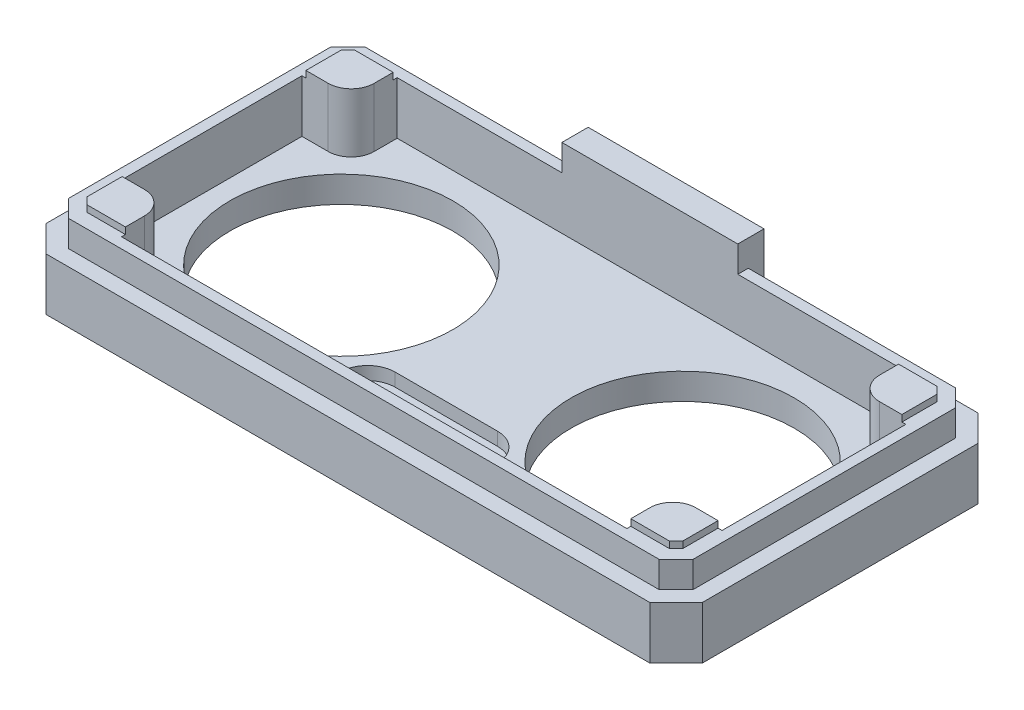
from build123d import *

# Parameters (mm, degrees)
BOSS_EXTRUDE1_DEPTH = 2
BOSS_EXTRUDE2_DEPTH = 4
BOSS_EXTRUDE3_DEPTH = 4
SKETCH3_R           = 8.5
FORSENSORS_DEPTH    = 5
FORCRYSTAL_DEPTH    = 1
PCBLEDGE_DEPTH      = 0.5
GROOVE_DEPTH        = 2
SKETCH7_W           = 13.4
SKETCH7_H           = 2
BOSS_EXTRUDE5_DEPTH = 2


with BuildPart() as part:
    # Sketch1 → Boss-Extrude1 (new body)
    with BuildSketch(Plane(origin=(0, 0, 0), x_dir=(1, 0, 0), z_dir=(0, 1, 0))):
        Polygon((7, 12.5), (-23, 12.5), (-25, 10.5), (-25, -10.5), (-23, -12.5), (23, -12.5), (25, -10.5), (25, 10.5), (23, 12.5), align=None)
    extrude(amount=BOSS_EXTRUDE1_DEPTH)

    # Sketch2 → Boss-Extrude2 (add)
    with BuildSketch(Plane(origin=(0, 2, 0), x_dir=(1, 0, 0), z_dir=(0, 1, 0))):
        with BuildLine():
            Line((-19.25, 8.75), (-19.25, 10.5))
            Line((-19.25, 10.5), (-22.171572875, 10.5))
            Line((-22.171572875, 10.5), (-23, 9.671572875))
            Line((-23, 9.671572875), (-23, 7))
            Line((-23, 7), (-21, 7))
            ThreePointArc((-21, 7), (-19.762563133, 7.512563133), (-19.25, 8.75))
        make_face()
        with BuildLine():
            Line((22.171572875, 10.5), (19.25, 10.5))
            Line((19.25, 10.5), (19.25, 8.75))
            ThreePointArc((19.25, 8.75), (19.762563133, 7.512563133), (21, 7))
            Line((21, 7), (23, 7))
            Line((23, 7), (23, 9.671572875))
            Line((23, 9.671572875), (22.171572875, 10.5))
        make_face()
        with BuildLine():
            Line((-21, -7), (-23, -7))
            Line((-23, -7), (-23, -9.671572875))
            Line((-23, -9.671572875), (-22.171572875, -10.5))
            Line((-22.171572875, -10.5), (-19.25, -10.5))
            Line((-19.25, -10.5), (-19.25, -8.75))
            ThreePointArc((-19.25, -8.75), (-19.762563133, -7.512563133), (-21, -7))
        make_face()
        with BuildLine():
            Line((23, -9.671572875), (23, -7))
            Line((23, -7), (21, -7))
            ThreePointArc((21, -7), (19.762563133, -7.512563133), (19.25, -8.75))
            Line((19.25, -8.75), (19.25, -10.5))
            Line((19.25, -10.5), (22.171572875, -10.5))
            Line((22.171572875, -10.5), (23, -9.671572875))
        make_face()
    extrude(amount=BOSS_EXTRUDE2_DEPTH)

    # Sketch2<3> → Boss-Extrude3 (add)
    with BuildSketch(Plane(origin=(0, 2, 0), x_dir=(1, 0, 0), z_dir=(0, 1, 0))):
        Polygon((23, 12.5), (7.5, 12.5), (-7.5, 12.5), (-23, 12.5), (-25, 10.5), (-25, -10.5), (-23, -12.5), (0, -12.5), (23, -12.5), (25, -10.5), (25, 10.5), align=None)
        Polygon((-19.25, 10.5), (-1.449649569, 10.5), (1.449649569, 10.5), (19.25, 10.5), (22.171572875, 10.5), (23, 9.671572875), (23, 7), (23, -7), (23, -9.671572875), (22.171572875, -10.5), (19.25, -10.5), (0, -10.5), (-19.25, -10.5), (-22.171572875, -10.5), (-23, -9.671572875), (-23, -7), (-23, 7), (-23, 9.671572875), (-22.171572875, 10.5), align=None, mode=Mode.SUBTRACT)
    extrude(amount=BOSS_EXTRUDE3_DEPTH)

    # Sketch3 → ForSensors (cut)
    with BuildSketch(Plane.XZ):
        with Locations((-13, 0)):
            Circle(SKETCH3_R)
        with Locations((13, 0)):
            Circle(SKETCH3_R)
    extrude(amount=-FORSENSORS_DEPTH, mode=Mode.SUBTRACT)

    # Sketch4 → ForCrystal (cut)
    with BuildSketch(Plane(origin=(0, 2, 0), x_dir=(1, 0, 0), z_dir=(0, 1, 0))):
        with BuildLine():
            Line((3.9, -9.2), (-3.9, -9.2))
            ThreePointArc((-3.9, -9.2), (-6, -7.1), (-3.9, -5))
            Line((-3.9, -5), (3.9, -5))
            ThreePointArc((3.9, -5), (6, -7.1), (3.9, -9.2))
        make_face()
    extrude(amount=-FORCRYSTAL_DEPTH, mode=Mode.SUBTRACT)

    # Sketch5 → PcbLedge (add)
    with BuildSketch(Plane(origin=(0, 6, 0), x_dir=(1, 0, 0), z_dir=(0, 1, 0))):
        with BuildLine():
            ThreePointArc((19.25, 8.75), (19.762563133, 7.512563133), (21, 7))
            Line((21, 7), (22.7, 7))
            Line((22.7, 7), (22.7, 9.688730163))
            Line((22.7, 9.688730163), (22.188730163, 10.2))
            Line((22.188730163, 10.2), (19.25, 10.2))
            Line((19.25, 10.2), (19.25, 8.75))
        make_face()
        with BuildLine():
            Line((22.7, -7), (21, -7))
            ThreePointArc((21, -7), (19.762563133, -7.512563133), (19.25, -8.75))
            Line((19.25, -8.75), (19.25, -10.2))
            Line((19.25, -10.2), (22.188730163, -10.2))
            Line((22.188730163, -10.2), (22.7, -9.688730163))
            Line((22.7, -9.688730163), (22.7, -7))
        make_face()
        with BuildLine():
            ThreePointArc((-21, 7), (-19.762563133, 7.512563133), (-19.25, 8.75))
            Line((-19.25, 8.75), (-19.25, 10.2))
            Line((-19.25, 10.2), (-22.188730163, 10.2))
            Line((-22.188730163, 10.2), (-22.7, 9.688730163))
            Line((-22.7, 9.688730163), (-22.7, 7))
            Line((-22.7, 7), (-21, 7))
        make_face()
        with BuildLine():
            Line((-19.25, -10.2), (-19.25, -8.75))
            ThreePointArc((-19.25, -8.75), (-19.762563133, -7.512563133), (-21, -7))
            Line((-21, -7), (-22.7, -7))
            Line((-22.7, -7), (-22.7, -9.688730163))
            Line((-22.7, -9.688730163), (-22.188730163, -10.2))
            Line((-22.188730163, -10.2), (-19.25, -10.2))
        make_face()
    extrude(amount=PCBLEDGE_DEPTH)

    # Sketch6 → Groove (cut)
    with BuildSketch(Plane(origin=(0, 6, 0), x_dir=(1, 0, 0), z_dir=(0, 1, 0))):
        Polygon((25, 10.5), (23, 12.5), (6.7, 12.5), (6.7, 11.3), (22.502943725, 11.3), (23.8, 10.002943725), (23.8, -10.002943725), (22.502943725, -11.3), (-22.502943725, -11.3), (-23.8, -10.002943725), (-23.8, 10.002943725), (-22.502943725, 11.3), (-6.7, 11.3), (-6.7, 12.5), (-23, 12.5), (-25, 10.5), (-25, -10.5), (-23, -12.5), (23, -12.5), (25, -10.5), align=None)
    extrude(amount=-GROOVE_DEPTH, mode=Mode.SUBTRACT)

    # Sketch7 → Boss-Extrude5 (add)
    with BuildSketch(Plane(origin=(0, 6, 0), x_dir=(1, 0, 0), z_dir=(0, 1, 0))):
        with Locations((0, 11.5)):
            Rectangle(SKETCH7_W, SKETCH7_H)
    extrude(amount=BOSS_EXTRUDE5_DEPTH)


solid = part.part
